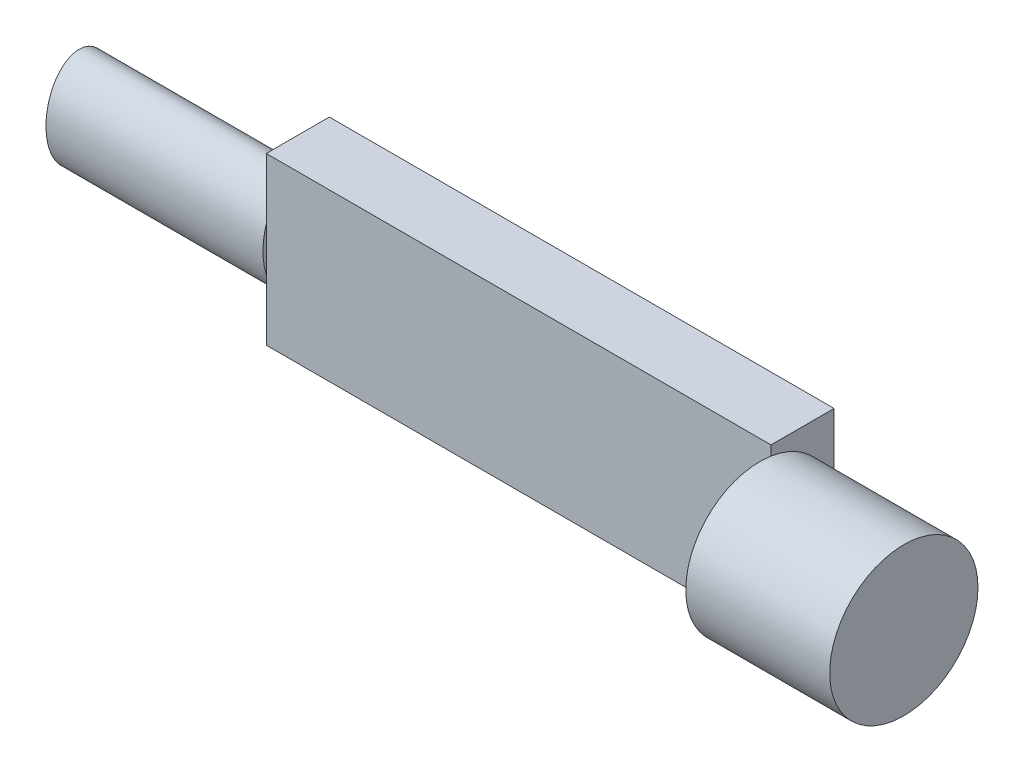
from build123d import *

# Parameters (mm, degrees)
SKETCH2_W           = 22.8
SKETCH2_H           = 7.5
BOSS_EXTRUDE1_DEPTH = 2.85
SKETCH3_R           = 3.35
BOSS_EXTRUDE2_DEPTH = 6.5
SKETCH4_RX          = 2.25
SKETCH4_RY          = 1.5
BOSS_EXTRUDE3_DEPTH = 9.8


with BuildPart() as part:
    # Sketch2 → Boss-Extrude1 (new body)
    with BuildSketch(Plane.XY):
        with Locations((11.4, 3.75)):
            Rectangle(SKETCH2_W, SKETCH2_H)
    extrude(amount=BOSS_EXTRUDE1_DEPTH)

    # Sketch3 → Boss-Extrude2 (add)
    with BuildSketch(Plane(origin=(22.8, 0, 0), x_dir=(0, 0, -1), z_dir=(1, 0, 0))):
        with Locations((-3.35, 3.75)):
            Circle(SKETCH3_R)
    extrude(amount=BOSS_EXTRUDE2_DEPTH)

    # Sketch4 → Boss-Extrude3 (add)
    with BuildSketch(Plane.ZY):
        with Locations(Location((1.5, 3.75), (0, 0, 90))):
            Ellipse(SKETCH4_RX, SKETCH4_RY)
    extrude(amount=BOSS_EXTRUDE3_DEPTH)


solid = part.part
